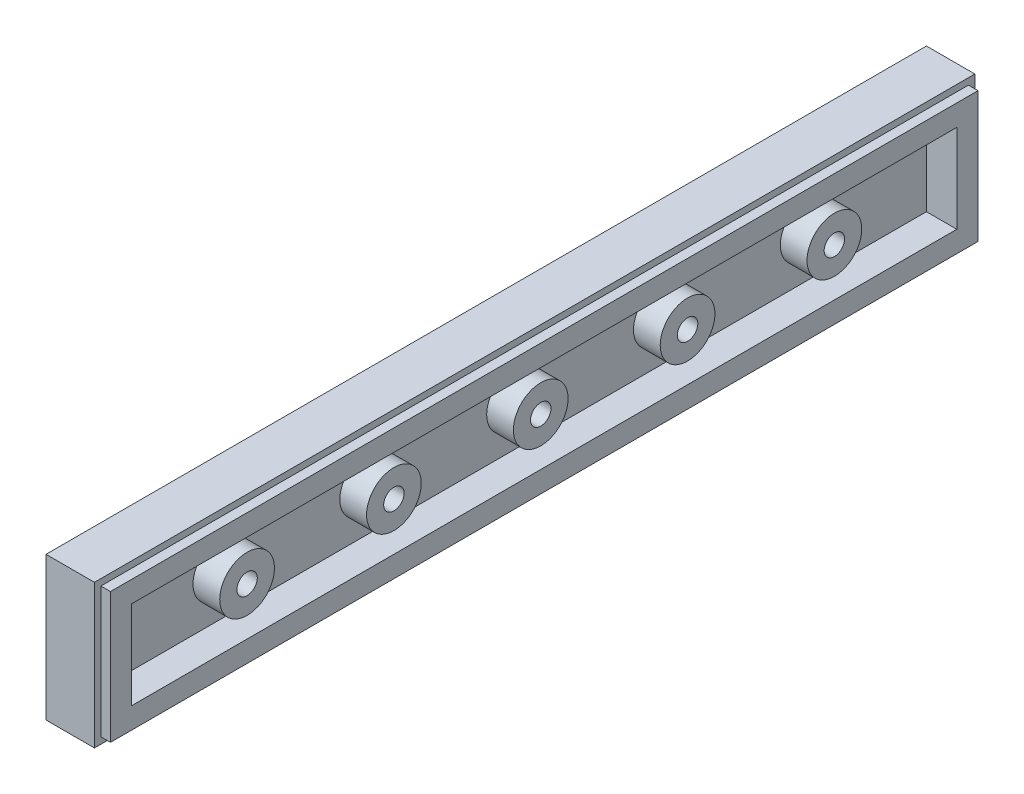
from build123d import *

# Parameters (mm, degrees)
SKETCH1_W           = 47.79
SKETCH1_H           = 7.79
BOSS_EXTRUDE1_DEPTH = 2.63
SHELL1_T            = -1.5
SKETCH2_W           = 47.09
SKETCH2_H           = 7.09
SKETCH2_W_2         = 44.79
SKETCH2_H_2         = 4.79
BOSS_EXTRUDE2_DEPTH = 0.52
SKETCH3_R           = 1.485
SKETCH3_R_2         = 0.555
BOSS_EXTRUDE3_DEPTH = 1.45


with BuildPart() as part:
    # Sketch1 → Boss-Extrude1 (new body)
    with BuildSketch(Plane(origin=(0, 0, 0), x_dir=(0, 0, -1), z_dir=(1, 0, 0))):
        Rectangle(SKETCH1_W, SKETCH1_H)
    extrude(amount=BOSS_EXTRUDE1_DEPTH)

    # Shell1
    shell1_openings = [part.faces().sort_by_distance(p)[0] for p in [
        (2.63, 0, 0),
    ]]
    offset(amount=SHELL1_T, openings=shell1_openings, kind=Kind.INTERSECTION)

    # Sketch2 → Boss-Extrude2 (add)
    with BuildSketch(Plane(origin=(2.63, 0, 0), x_dir=(0, 0, -1), z_dir=(1, 0, 0))):
        Rectangle(SKETCH2_W, SKETCH2_H)
        Rectangle(SKETCH2_W_2, SKETCH2_H_2, mode=Mode.SUBTRACT)
    extrude(amount=BOSS_EXTRUDE2_DEPTH)

    # Sketch3 → Boss-Extrude3 (add)
    # profile 1 of 5: a face of its own
    with BuildSketch(Plane(origin=(1.5, 0, 0), x_dir=(0, 0, -1), z_dir=(1, 0, 0))):
        with Locations(Location((-15.93, 0, 0), (0, 0, 180))):
            Circle(SKETCH3_R)
        with Locations(Location((-15.93, 0, 0), (0, 0, 180))):
            Circle(SKETCH3_R_2, mode=Mode.SUBTRACT)
    # profile 2 of 5: a face of its own
    with BuildSketch(Plane(origin=(1.5, 0, 0), x_dir=(0, 0, -1), z_dir=(1, 0, 0))):
        with Locations(Location((-7.96, 0, 0), (0, 0, 180))):
            Circle(SKETCH3_R)
        with Locations(Location((-7.96, 0, 0), (0, 0, 180))):
            Circle(SKETCH3_R_2, mode=Mode.SUBTRACT)
    # profile 3 of 5: a face of its own
    with BuildSketch(Plane(origin=(1.5, 0, 0), x_dir=(0, 0, -1), z_dir=(1, 0, 0))):
        with Locations(Location((0.01, 0, 0), (0, 0, 180))):
            Circle(SKETCH3_R)
        with Locations(Location((0.01, 0, 0), (0, 0, 180))):
            Circle(SKETCH3_R_2, mode=Mode.SUBTRACT)
    # profile 4 of 5: a face of its own
    with BuildSketch(Plane(origin=(1.5, 0, 0), x_dir=(0, 0, -1), z_dir=(1, 0, 0))):
        with Locations(Location((7.98, 0, 0), (0, 0, 180))):
            Circle(SKETCH3_R)
        with Locations(Location((7.98, 0, 0), (0, 0, 180))):
            Circle(SKETCH3_R_2, mode=Mode.SUBTRACT)
    # profile 5 of 5: a face of its own
    with BuildSketch(Plane(origin=(1.5, 0, 0), x_dir=(0, 0, -1), z_dir=(1, 0, 0))):
        with Locations(Location((15.95, 0, 0), (0, 0, 180))):
            Circle(SKETCH3_R)
        with Locations(Location((15.95, 0, 0), (0, 0, 180))):
            Circle(SKETCH3_R_2, mode=Mode.SUBTRACT)
    extrude(amount=BOSS_EXTRUDE3_DEPTH)


solid = part.part
